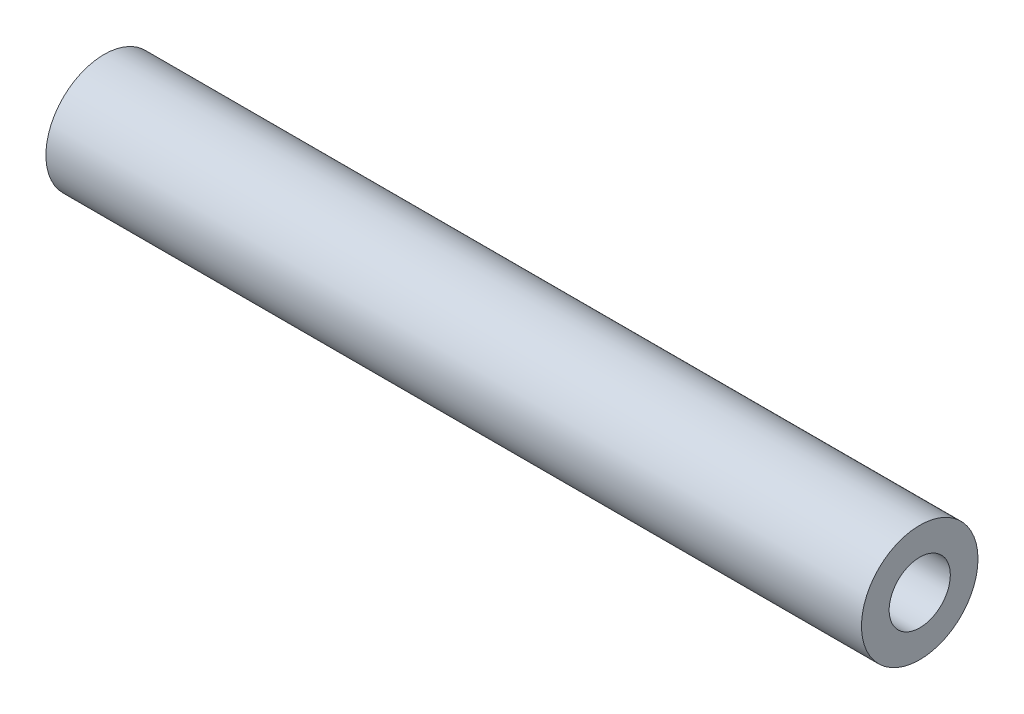
from build123d import *

# Parameters (mm, degrees)
SKETCH_1_R      = 4
SKETCH_1_R_2    = 2.1
EXTRUDE_1_DEPTH = 56


with BuildPart() as part:
    # 草图1 → 凸台-拉伸1 (new body)
    with BuildSketch(Plane(origin=(0, 0, 0), x_dir=(0, 0, -1), z_dir=(1, 0, 0))):
        Circle(SKETCH_1_R)
        Circle(SKETCH_1_R_2, mode=Mode.SUBTRACT)
    extrude(amount=EXTRUDE_1_DEPTH)


solid = part.part
